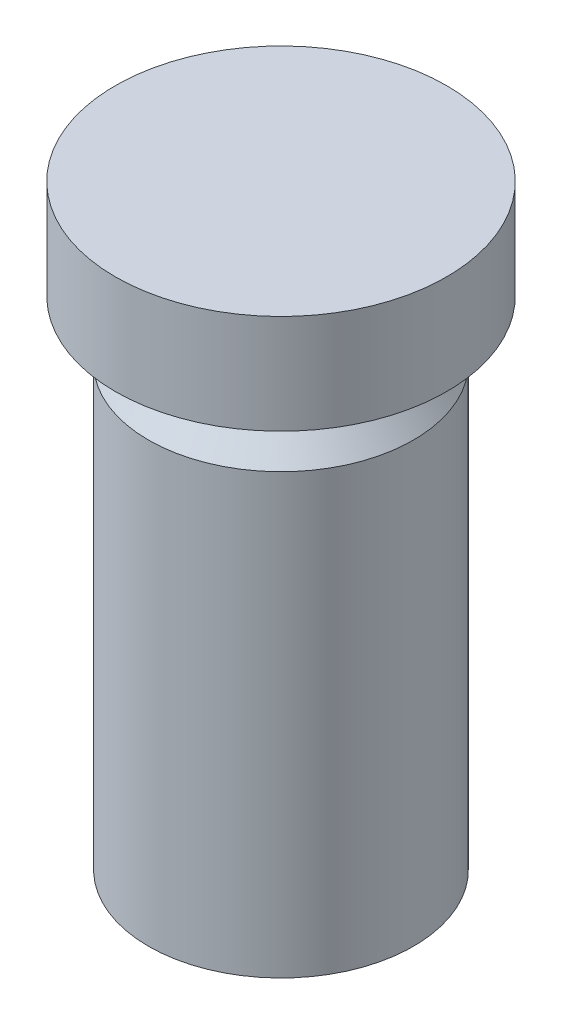
from build123d import *

# Parameters (mm, degrees)
SKETCH3_R          = 4.7625
CUT_EXTRUDE1_DEPTH = 66.838201297


with BuildPart() as part:
    # Sketch2 → Revolve1 (revolve)
    with BuildSketch(Plane.XY, mode=Mode.PRIVATE) as revolve1_sk:
        Polygon((2.040850661, 44.45), (0, 42.017808893), (0, 0), (2.2225, 0), (2.2225, 12.7), (12.7, 12.7), (12.7, 57.15), (-3.175, 57.15), (-3.175, 47.625), (9.525, 47.625), (9.525, 44.45), align=None)
    revolve(revolve1_sk.sketch.rotate(Axis((12.7, 12.7, 0), (0, 1, 0)), 270), axis=Axis((12.7, 12.7, 0), (0, 1, 0)))

    # Sketch3 → Cut-Extrude1 (cut, through all)
    with BuildSketch(Plane.XY):
        with Locations((12.7, 25.4)):
            Circle(SKETCH3_R)
    extrude(amount=-CUT_EXTRUDE1_DEPTH, mode=Mode.SUBTRACT)


solid = part.part
